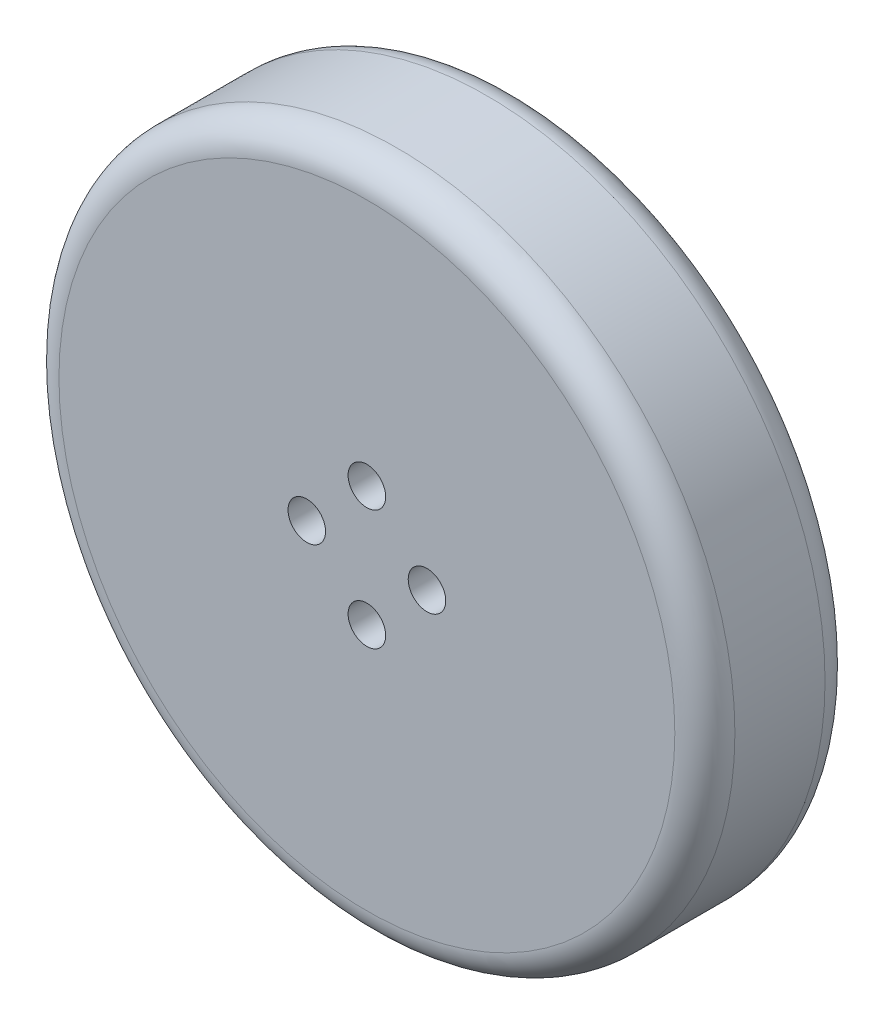
from build123d import *

# Parameters (mm, degrees)
SKETCH2_R           = 22.5
SKETCH2_R_2         = 1.25
BOSS_EXTRUDE1_DEPTH = 10
SKETCH3_R           = 10
CUT_EXTRUDE1_DEPTH  = 4
FILLET1_R           = 2


with BuildPart() as part:
    # Sketch2 → Boss-Extrude1 (new body)
    with BuildSketch(Plane.XY):
        Circle(SKETCH2_R)
        with Locations((4, 0)):
            Circle(SKETCH2_R_2, mode=Mode.SUBTRACT)
        with Locations((0, 4)):
            Circle(SKETCH2_R_2, mode=Mode.SUBTRACT)
        with Locations((-4, 0)):
            Circle(SKETCH2_R_2, mode=Mode.SUBTRACT)
        with Locations((0, -4)):
            Circle(SKETCH2_R_2, mode=Mode.SUBTRACT)
    extrude(amount=BOSS_EXTRUDE1_DEPTH)

    # Sketch3 → Cut-Extrude1 (cut)
    with BuildSketch(Plane(origin=(0, 0, 0), x_dir=(-1, 0, 0), z_dir=(0, 0, -1))):
        Circle(SKETCH3_R)
    extrude(amount=-CUT_EXTRUDE1_DEPTH, mode=Mode.SUBTRACT)

    # Fillet1
    fillet1_edges = [part.edges().sort_by_distance(p)[0] for p in [
        (-22.5, 0, 0),
        (-22.5, 0, 10),
    ]]
    fillet(fillet1_edges, radius=FILLET1_R)


solid = part.part
